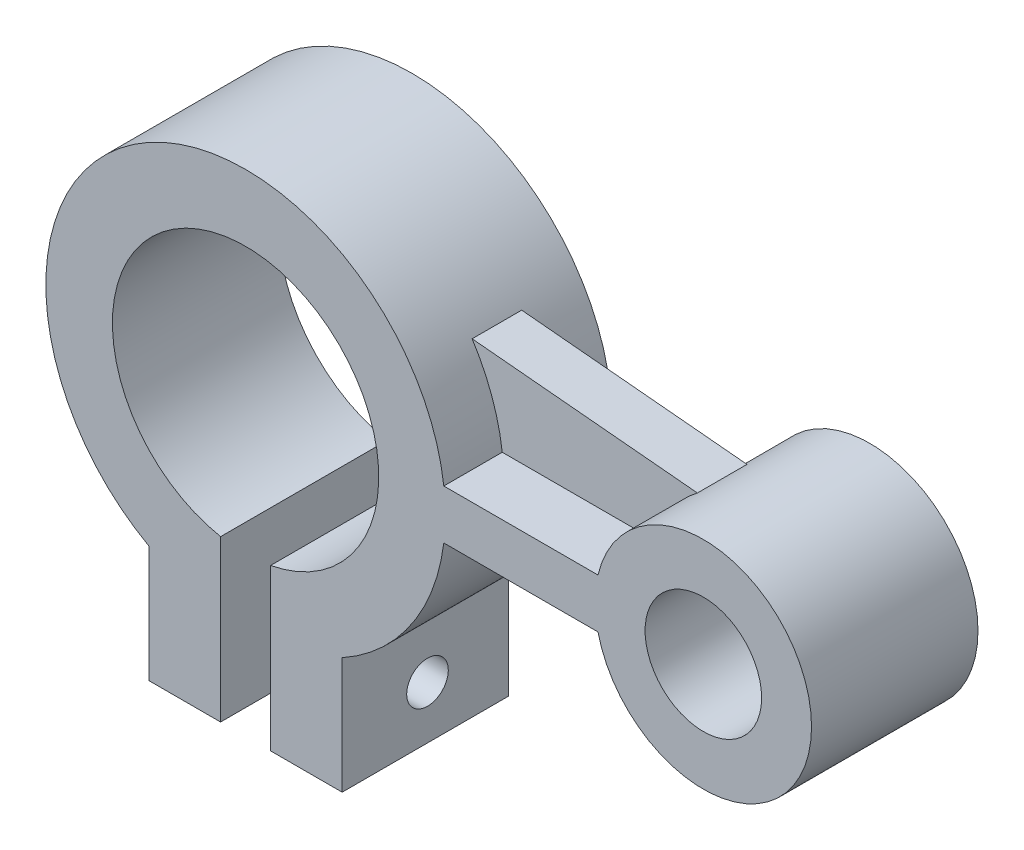
from build123d import *

# Parameters (mm, degrees)
SKETCH1_R           = 17.78
BOSS_EXTRUDE2_DEPTH = 50.8
SKETCH2_W           = 73.862630268
SKETCH2_H           = 15.124217288
BOSS_EXTRUDE3_DEPTH = 25.4
CUT_EXTRUDE1_DEPTH  = 50.8
SKETCH4_R           = 6.35
CUT_EXTRUDE2_DEPTH  = 63.5


with BuildPart() as part:
    # Sketch1 → Boss-Extrude2 (new body)
    with BuildSketch(Plane.XY):
        with BuildLine():
            ThreePointArc((-9.204181185, 0), (-18.526895851, -25.90052585), (-42.217824852, -39.918019604))
            Line((-42.217824852, -39.918019604), (-42.217824852, -88.920040919))
            Line((-42.217824852, -88.920040919), (-20.368298956, -88.920040919))
            Line((-20.368298956, -88.920040919), (-20.368298956, -53.360040919))
            ThreePointArc((-20.368298956, -53.360040919), (0.642357728, -34.164762381), (10.649776088, -7.523478812))
            Line((10.649776088, -7.523478812), (57.70433881, -7.523478812))
            ThreePointArc((57.70433881, -7.523478812), (122.875818815, 0), (57.70433881, 7.523478812))
            Line((57.70433881, 7.523478812), (10.649776088, 7.523478812))
            ThreePointArc((10.649776088, 7.523478812), (-84.008943566, 50.486538913), (-79.320063413, -53.360040919))
            Line((-79.320063413, -53.360040919), (-79.320063413, -88.920040919))
            Line((-79.320063413, -88.920040919), (-57.470537518, -88.920040919))
            Line((-57.470537518, -88.920040919), (-57.470537518, -39.918019604))
            ThreePointArc((-57.470537518, -39.918019604), (-75.744707035, 31.317285334), (-9.204181185, 0))
        make_face()
        with Locations((89.855818815, 0)):
            Circle(SKETCH1_R, mode=Mode.SUBTRACT)
    extrude(amount=BOSS_EXTRUDE2_DEPTH)

    # Sketch2 → Boss-Extrude3 (add, symmetric)
    with BuildSketch(Plane(origin=(0, 7.523478812, 0), x_dir=(1, 0, 0), z_dir=(0, 1, 0))):
        with Locations((33.279016798, -25.4)):
            Rectangle(SKETCH2_W, SKETCH2_H)
    extrude(amount=BOSS_EXTRUDE3_DEPTH, both=True)

    # Sketch3 → Cut-Extrude1 (cut)
    with BuildSketch(Plane.XY.offset(32.962108644)):
        Polygon((70.210331932, 26.540068672), (1.460459374, 32.923478812), (70.210331932, 32.923478812), align=None)
    extrude(amount=-CUT_EXTRUDE1_DEPTH, mode=Mode.SUBTRACT)

    # Sketch4 → Cut-Extrude2 (cut)
    with BuildSketch(Plane(origin=(-20.368298956, 0, 0), x_dir=(0, 0, -1), z_dir=(1, 0, 0))):
        with Locations(Location((-24.762227367, -72.866633354, 0), (0, 0, 90))):
            Circle(SKETCH4_R)
    extrude(amount=-CUT_EXTRUDE2_DEPTH, mode=Mode.SUBTRACT)


solid = part.part
